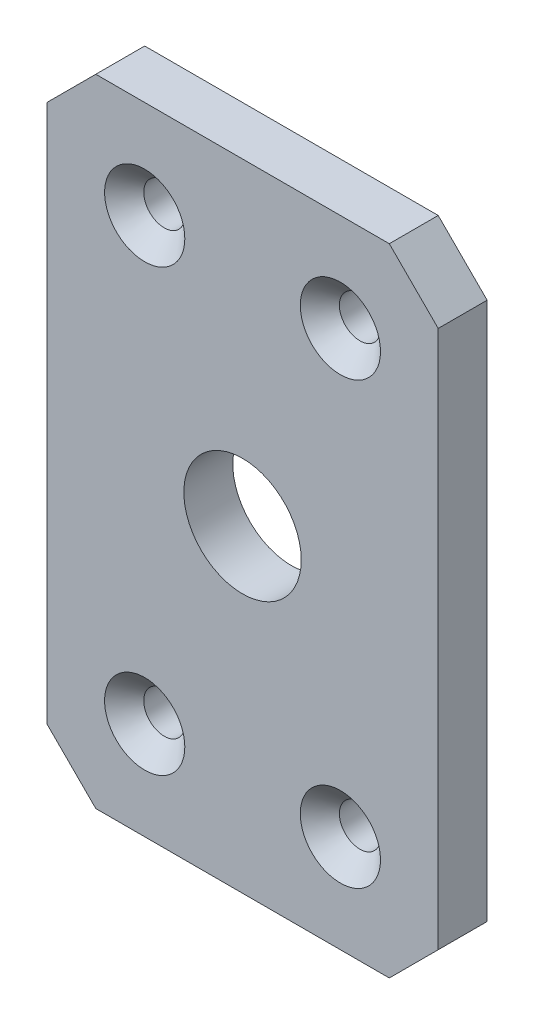
from build123d import *

# Parameters (mm, degrees)
SKETCH_1_W               = 40
SKETCH_1_H               = 65
SKETCH_1_R               = 6
EXTRUDE_1_DEPTH          = 2.5
CUT_EXTRUDE_1_DEPTH      = 39.487010796
CUT_EXTRUDE_1_DEPTH_BACK = 39.487010796
SKETCH_2_R               = 2.1
CHAMFER_1_SIZE           = 2
CHAMFER_2_SIZE           = 5


with BuildPart() as part:
    # 草图1 → 凸台-拉伸1 (new, symmetric)
    with BuildSketch(Plane.XY):
        Rectangle(SKETCH_1_W, SKETCH_1_H)
        Circle(SKETCH_1_R, mode=Mode.SUBTRACT)
    extrude(amount=EXTRUDE_1_DEPTH, both=True)

    # 草图2 → 切除-拉伸1 (cut, two sides: drawn at the far end of the back side and taken through both)
    with BuildSketch(Plane(origin=(0, 0, -2.5), x_dir=(-1, 0, 0), z_dir=(0, 0, -1)).offset(-CUT_EXTRUDE_1_DEPTH_BACK)):
        with Locations((-10, 22.5)):
            Circle(SKETCH_2_R)
        with Locations((10, 22.5)):
            Circle(SKETCH_2_R)
        with Locations((10, -22.5)):
            Circle(SKETCH_2_R)
        with Locations((-10, -22.5)):
            Circle(SKETCH_2_R)
    extrude(amount=CUT_EXTRUDE_1_DEPTH + CUT_EXTRUDE_1_DEPTH_BACK, mode=Mode.SUBTRACT)

    # 倒角1
    chamfer_1_edges = [part.edges().sort_by_distance(p)[0] for p in [
        (12.1, -22.5, 2.5),
        (-7.9, -22.5, 2.5),
        (-7.9, 22.5, 2.5),
        (12.1, 22.5, 2.5),
    ]]
    chamfer(chamfer_1_edges, length=CHAMFER_1_SIZE)

    # 倒角2
    chamfer_2_edges = [part.edges().sort_by_distance(p)[0] for p in [
        (-20, 32.5, 0),
        (20, 32.5, 0),
        (20, -32.5, 0),
        (-20, -32.5, 0),
    ]]
    chamfer(chamfer_2_edges, length=CHAMFER_2_SIZE)


solid = part.part
